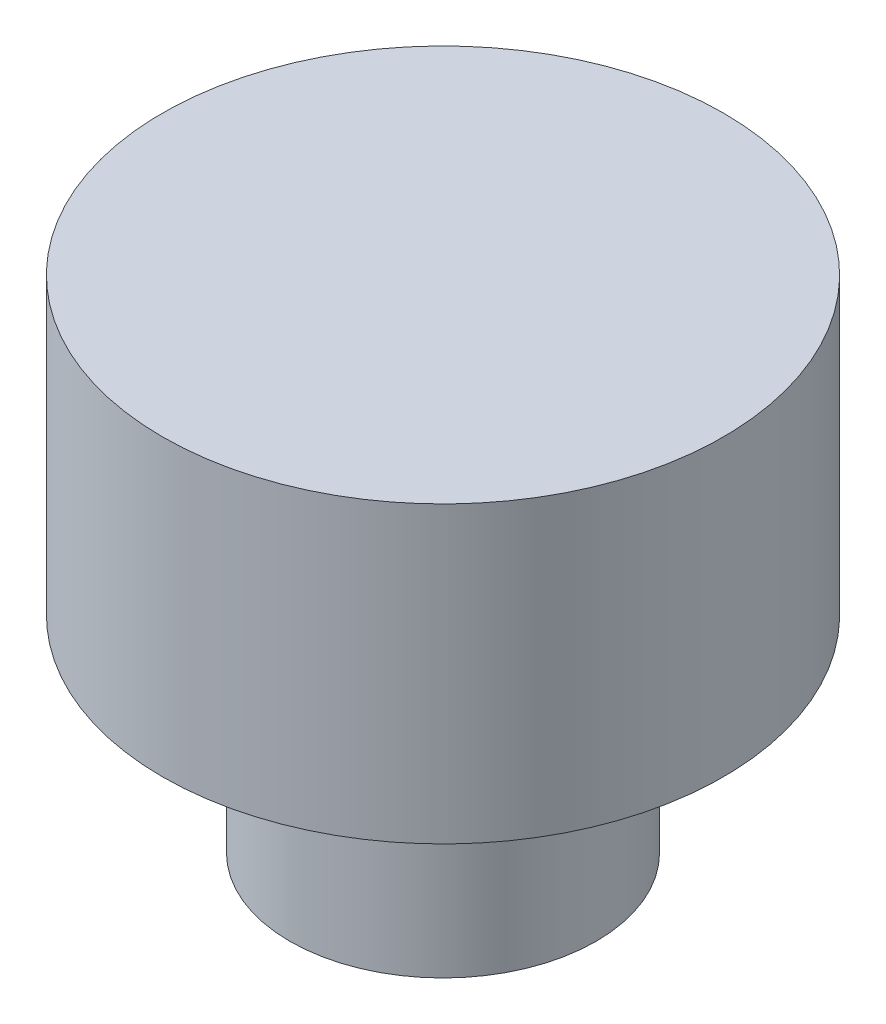
from build123d import *

# Parameters (mm, degrees)
SKETCH1_R           = 5.2
SKETCH1_R_2         = 3.2
BOSS_EXTRUDE1_DEPTH = 7
SKETCH2_R           = 9.525
BOSS_EXTRUDE2_DEPTH = 10
BOSS_EXTRUDE3_START = 0.8
BOSS_EXTRUDE3_DEPTH = 0.8


with BuildPart() as part:
    # Sketch1 → Boss-Extrude1 (new body)
    with BuildSketch(Plane(origin=(0, 0, 0), x_dir=(1, 0, 0), z_dir=(0, 1, 0))):
        with Locations(Location((0, 0, 0), (0, 0, 270))):
            Circle(SKETCH1_R)
        with Locations(Location((0, 0, 0), (0, 0, 270))):
            Circle(SKETCH1_R_2, mode=Mode.SUBTRACT)
    extrude(amount=BOSS_EXTRUDE1_DEPTH)

    # Sketch2 → Boss-Extrude2 (add)
    with BuildSketch(Plane(origin=(0, 7, 0), x_dir=(1, 0, 0), z_dir=(0, 1, 0))):
        with Locations(Location((0, 0, 0), (0, 0, 270))):
            Circle(SKETCH2_R)
    extrude(amount=BOSS_EXTRUDE2_DEPTH)

    # Sketch3 → Boss-Extrude3 (add)
    with BuildSketch(Plane.XZ.offset(-7).offset(BOSS_EXTRUDE3_START)):
        with BuildLine():
            Line((3.122498999, 0.7), (-3.122498999, 0.7))
            ThreePointArc((-3.122498999, 0.7), (-3.180565736, 0.352138611), (-3.2, 0))
            ThreePointArc((-3.2, 0), (-3.180565736, -0.352138611), (-3.122498999, -0.7))
            Line((-3.122498999, -0.7), (3.122498999, -0.7))
            ThreePointArc((3.122498999, -0.7), (3.180565736, -0.352138611), (3.2, 0))
            ThreePointArc((3.2, 0), (3.180565736, 0.352138611), (3.122498999, 0.7))
        make_face()
    extrude(amount=-BOSS_EXTRUDE3_DEPTH)


solid = part.part
